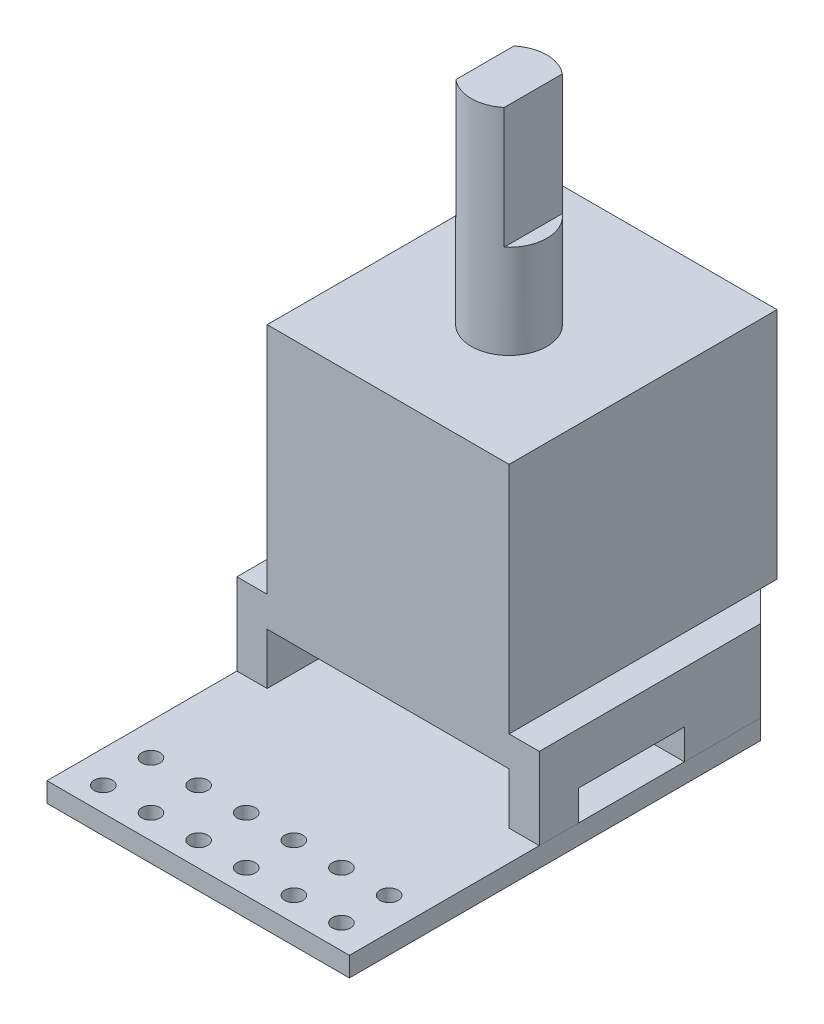
from build123d import *

# Parameters (mm, degrees)
SKETCH1_W            = 10.16
SKETCH1_H            = 11.2522
EXTRUDE1_DEPTH       = 9.8044
SKETCH2_R            = 1.5875
EXTRUDE2_DEPTH       = 9.017
EXTRUDE3_DEPTH       = 21.290502684
EXTRUDE3_DEPTH_BACK  = 21.290502684
SKETCH3_W            = 0.5715
SKETCH3_H            = 5.08
SKETCH4_W            = 12.7
SKETCH4_H            = 10.5664
EXTRUDE4_DEPTH       = 3.429
SKETCH5_W            = 10.16
SKETCH5_H            = 2.159
EXTRUDE5_DEPTH       = 23.829358353
SKETCH6_W            = 4.445
SKETCH6_H            = 1.27
EXTRUDE6_DEPTH       = 1.27
SKETCH7_W            = 5.9944
SKETCH7_H            = 1.27
EXTRUDE7_DEPTH       = 1.27
EXTRUDE8_REACH       = 22.645
PCB_DEPTH            = 0.8255
SKETCH10_R           = 0.381
EXTRUDE10_DEPTH      = 0.8255
LPATTERN1_COUNT      = 6
LPATTERN1_PITCH      = 2
LPATTERN1_COUNT_DIR2 = 2
LPATTERN1_PITCH_DIR2 = 2


with BuildPart() as part:
    # Sketch1 → Extrude1 (new body)
    with BuildSketch(Plane(origin=(0, 0, 0), x_dir=(1, 0, 0), z_dir=(0, 1, 0))):
        Rectangle(SKETCH1_W, SKETCH1_H)
    extrude(amount=EXTRUDE1_DEPTH)

    # Sketch2 → Extrude2 (add)
    with BuildSketch(Plane(origin=(0, 9.8044, 0), x_dir=(1, 0, 0), z_dir=(0, 1, 0))):
        with Locations(Location((0, -0.5461, 0), (0, 0, 270))):
            Circle(SKETCH2_R)
    extrude(amount=EXTRUDE2_DEPTH)

    # Sketch3 → Extrude3 (cut, two sides: drawn at the far end of the back side and taken through both)
    with BuildSketch(Plane.XY.offset(-EXTRUDE3_DEPTH_BACK)):
        with Locations((-1.30175, 16.2814)):
            Rectangle(SKETCH3_W, SKETCH3_H)
        with Locations((1.30175, 16.2814)):
            Rectangle(SKETCH3_W, SKETCH3_H)
    extrude(amount=EXTRUDE3_DEPTH + EXTRUDE3_DEPTH_BACK, mode=Mode.SUBTRACT)

    # Sketch4 → Extrude4 (add)
    with BuildSketch(Plane.XZ):
        with Locations((0, 0.3429)):
            Rectangle(SKETCH4_W, SKETCH4_H)
    extrude(amount=EXTRUDE4_DEPTH)

    # Sketch5 → Extrude5 (cut, through all)
    with BuildSketch(Plane.XY.offset(5.6261)):
        with Locations((0, -2.3495)):
            Rectangle(SKETCH5_W, SKETCH5_H)
    extrude(amount=-EXTRUDE5_DEPTH, mode=Mode.SUBTRACT)

    # Sketch6 → Extrude6 (cut)
    with BuildSketch(Plane(origin=(6.35, 0, 0), x_dir=(0, 0, -1), z_dir=(1, 0, 0))):
        with Locations((-1.7526, -2.794)):
            Rectangle(SKETCH6_W, SKETCH6_H)
    extrude(amount=-EXTRUDE6_DEPTH, mode=Mode.SUBTRACT)

    # Sketch7 → Extrude7 (cut)
    with BuildSketch(Plane.ZY.offset(6.35)):
        with Locations((-1.9431, -2.794)):
            Rectangle(SKETCH7_W, SKETCH7_H)
    extrude(amount=-EXTRUDE7_DEPTH, mode=Mode.SUBTRACT)

    # Extrude8: up to this face of the body (flat: up to its plane)
    extrude8_end = Plane(part.part.faces().sort_by_distance((5.715, -3.429, -2.7051))[0])
    # Sketch8 → Extrude8 (cut, up to the picked face)
    with BuildSketch(Plane(origin=(0, 0, 0), x_dir=(1, 0, 0), z_dir=(0, 1, 0)), mode=Mode.PRIVATE) as extrude8_sk1:
        Polygon((5.08, 4.9403), (6.35, 3.6703), (6.35, 4.9403), (6.35, 5.384756182), (-6.35, 5.384756182), (-6.35, 3.6703), (-5.08, 4.9403), align=None)
    extrude8_tool1 = split(extrude(extrude8_sk1.sketch, amount=-EXTRUDE8_REACH, mode=Mode.PRIVATE), bisect_by=extrude8_end, keep=Keep.BOTH, mode=Mode.PRIVATE)
    add(extrude8_tool1.solids().sort_by(Axis((0, 0, -5.019059), (0, -1, 0)))[0], mode=Mode.SUBTRACT)


with BuildPart() as body_2:
    # Sketch9 → PCB (new body)
    with BuildSketch(Plane.XZ.offset(3.429)):
        Polygon((5.08, -4.9403), (-5.08, -4.9403), (-6.35, -3.6703), (-6.35, 13.6017), (6.35, 13.6017), (6.35, -3.6703), align=None)
    extrude(amount=PCB_DEPTH)

    # Sketch10 → Extrude10 (cut)
    with BuildSketch(Plane(origin=(0, -3.429, 0), x_dir=(1, 0, 0), z_dir=(0, 1, 0))):
        with Locations(Location((-5, -12.5857, 0), (0, 0, 270))):
            Circle(SKETCH10_R)
    extrude10 = extrude(amount=-EXTRUDE10_DEPTH, mode=Mode.SUBTRACT)

    # LPattern1: Extrude10 6 × 2
    with Locations(*[(i * LPATTERN1_PITCH, 0, -j * LPATTERN1_PITCH_DIR2) for i in range(LPATTERN1_COUNT) for j in range(LPATTERN1_COUNT_DIR2) if (i, j) != (0, 0)]):
        add(extrude10, mode=Mode.SUBTRACT)


solid = Compound([part.part, body_2.part])
